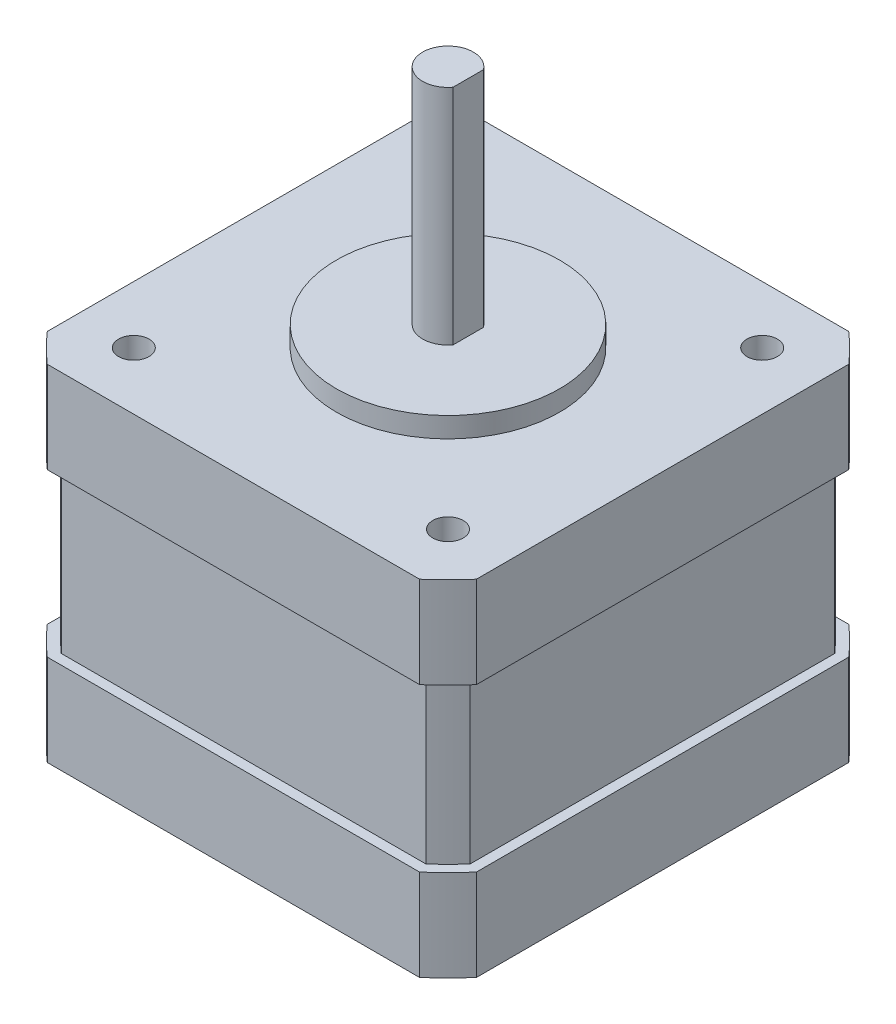
from build123d import *

# Parameters (mm, degrees)
BOSS_EXTRUDE1_DEPTH = 24
SKETCH2_R           = 11
BOSS_EXTRUDE2_DEPTH = 2
BOSS_EXTRUDE3_DEPTH = 9
BOSS_EXTRUDE4_DEPTH = 16
BOSS_EXTRUDE5_DEPTH = 9
SKETCH6_R           = 1.5
CUT_EXTRUDE1_DEPTH  = 4.5


with BuildPart() as part:
    # Sketch1 → Boss-Extrude1 (new body)
    with BuildSketch(Plane(origin=(0, 0, 0), x_dir=(1, 0, 0), z_dir=(0, 1, 0))):
        with BuildLine():
            Line((2, 1.5), (2, -1.5))
            ThreePointArc((2, -1.5), (-2.5, 0), (2, 1.5))
        make_face()
    extrude(amount=BOSS_EXTRUDE1_DEPTH)

    # Sketch2 → Boss-Extrude2 (add)
    with BuildSketch(Plane(origin=(0, 0, 0), x_dir=(1, 0, 0), z_dir=(0, 1, 0))):
        with Locations(Location((0, 0, 0), (0, 0, 270))):
            Circle(SKETCH2_R)
    extrude(amount=BOSS_EXTRUDE2_DEPTH)

    # Sketch3 → Boss-Extrude3 (add)
    with BuildSketch(Plane(origin=(0, 0, 0), x_dir=(1, 0, 0), z_dir=(0, 1, 0))):
        with BuildLine():
            Line((-18.348773801, 21.15), (18.348773801, 21.15))
            ThreePointArc((18.348773801, 21.15), (19.798989873, 19.798989873), (21.15, 18.348773801))
            Line((21.15, 18.348773801), (21.15, -18.348773801))
            ThreePointArc((21.15, -18.348773801), (19.798989873, -19.798989873), (18.348773801, -21.15))
            Line((18.348773801, -21.15), (-18.348773801, -21.15))
            ThreePointArc((-18.348773801, -21.15), (-19.798989873, -19.798989873), (-21.15, -18.348773801))
            Line((-21.15, -18.348773801), (-21.15, 18.348773801))
            ThreePointArc((-21.15, 18.348773801), (-19.798989873, 19.798989873), (-18.348773801, 21.15))
        make_face()
    extrude(amount=-BOSS_EXTRUDE3_DEPTH)

    # Sketch4 → Boss-Extrude4 (add)
    with BuildSketch(Plane.XZ.offset(9)):
        with BuildLine():
            Line((20.15, -17.971574778), (20.15, 17.971574778))
            ThreePointArc((20.15, 17.971574778), (19.091883092, 19.091883092), (17.971574778, 20.15))
            Line((17.971574778, 20.15), (-17.971574778, 20.15))
            ThreePointArc((-17.971574778, 20.15), (-19.091883092, 19.091883092), (-20.15, 17.971574778))
            Line((-20.15, 17.971574778), (-20.15, -17.971574778))
            ThreePointArc((-20.15, -17.971574778), (-19.091883092, -19.091883092), (-17.971574778, -20.15))
            Line((-17.971574778, -20.15), (17.971574778, -20.15))
            ThreePointArc((17.971574778, -20.15), (19.091883092, -19.091883092), (20.15, -17.971574778))
        make_face()
    extrude(amount=BOSS_EXTRUDE4_DEPTH)

    # Sketch5 → Boss-Extrude5 (add)
    with BuildSketch(Plane.XZ.offset(25)):
        with BuildLine():
            Line((21.15, -18.348773801), (21.15, 18.348773801))
            ThreePointArc((21.15, 18.348773801), (19.798989873, 19.798989873), (18.348773801, 21.15))
            Line((18.348773801, 21.15), (-18.348773801, 21.15))
            ThreePointArc((-18.348773801, 21.15), (-19.798989873, 19.798989873), (-21.15, 18.348773801))
            Line((-21.15, 18.348773801), (-21.15, -18.348773801))
            ThreePointArc((-21.15, -18.348773801), (-19.798989873, -19.798989873), (-18.348773801, -21.15))
            Line((-18.348773801, -21.15), (18.348773801, -21.15))
            ThreePointArc((18.348773801, -21.15), (19.798989873, -19.798989873), (21.15, -18.348773801))
        make_face()
    extrude(amount=BOSS_EXTRUDE5_DEPTH)

    # Sketch6 → Cut-Extrude1 (cut)
    with BuildSketch(Plane(origin=(0, 0, 0), x_dir=(1, 0, 0), z_dir=(0, 1, 0))):
        with Locations(Location((-15.485638508, 15.485638508, 0), (0, 0, 270))):
            Circle(SKETCH6_R)
        with Locations(Location((15.485638508, 15.485638508, 0), (0, 0, 270))):
            Circle(SKETCH6_R)
        with Locations(Location((15.485638508, -15.485638508, 0), (0, 0, 270))):
            Circle(SKETCH6_R)
        with Locations(Location((-15.485638508, -15.485638508, 0), (0, 0, 270))):
            Circle(SKETCH6_R)
    extrude(amount=-CUT_EXTRUDE1_DEPTH, mode=Mode.SUBTRACT)


solid = part.part
